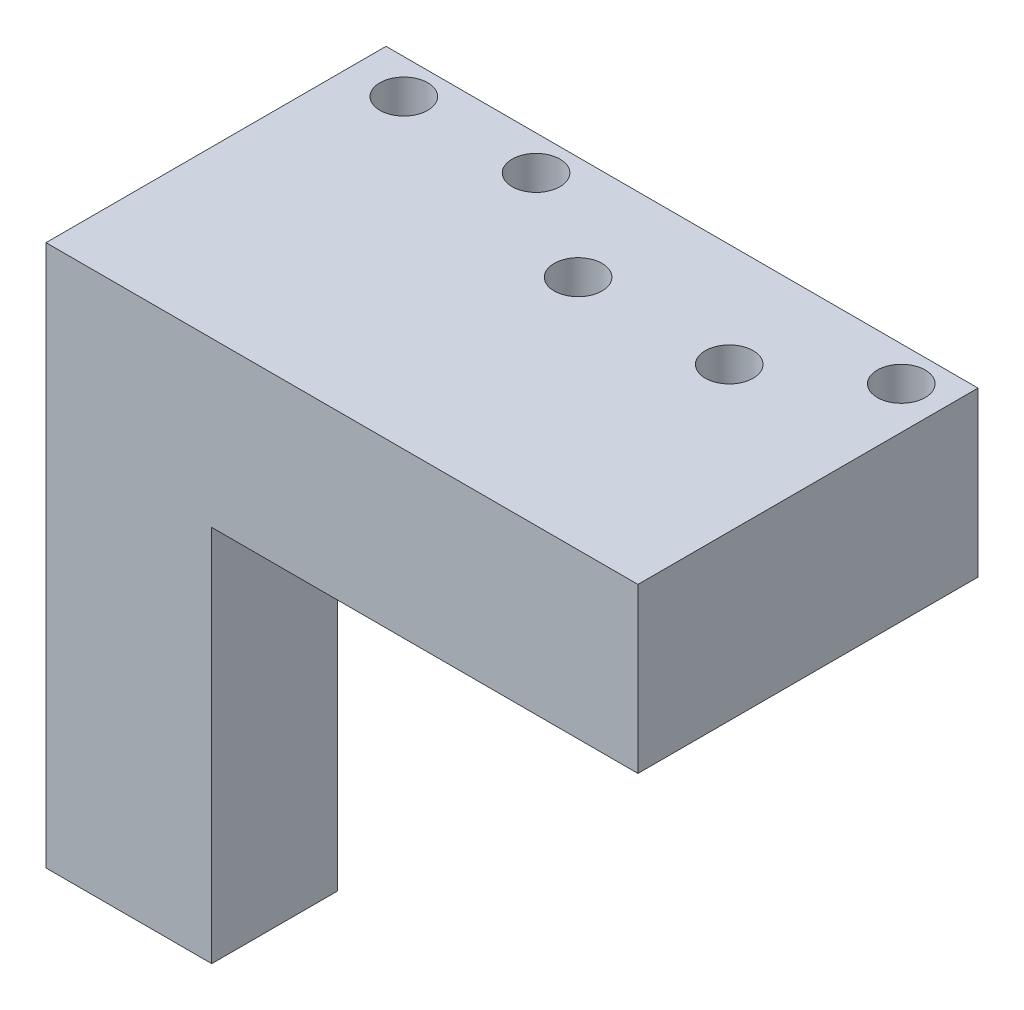
from build123d import *

# Parameters (mm, degrees)
SKETCH_1_R      = 1.9
EXTRUDE_1_DEPTH = 13
SKETCH_2_W      = 13.159242617
SKETCH_2_H      = 30
EXTRUDE_2_DEPTH = 10


with BuildPart() as part:
    # 草图1 → 凸台-拉伸1 (new body)
    with BuildSketch(Plane(origin=(0, 0, 0), x_dir=(1, 0, 0), z_dir=(0, 1, 0))):
        Polygon((-23.5, -5.5), (-23.5, -21.5), (23.5, -21.5), (23.5, -5.5), (23.5, 5.5), (-23.5, 5.5), align=None)
        with Locations(Location((20.159242617, 2.75, 0), (0, 0, 90))):
            Circle(SKETCH_1_R, mode=Mode.SUBTRACT)
        with Locations(Location((-8.840757383, 2.75, 0), (0, 0, 90))):
            Circle(SKETCH_1_R, mode=Mode.SUBTRACT)
        with Locations(Location((-19.340757383, 2.75, 0), (0, 0, 90))):
            Circle(SKETCH_1_R, mode=Mode.SUBTRACT)
        with Locations(Location((0, -2.75, 0), (0, 0, 90))):
            Circle(SKETCH_1_R, mode=Mode.SUBTRACT)
        with Locations(Location((12, -2.75, 0), (0, 0, 90))):
            Circle(SKETCH_1_R, mode=Mode.SUBTRACT)
    extrude(amount=EXTRUDE_1_DEPTH)

    # 草图2 → 凸台-拉伸2 (add)
    with BuildSketch(Plane.XY.offset(21.5)):
        with Locations((-16.920378692, -15)):
            Rectangle(SKETCH_2_W, SKETCH_2_H)
    extrude(amount=-EXTRUDE_2_DEPTH)


solid = part.part
